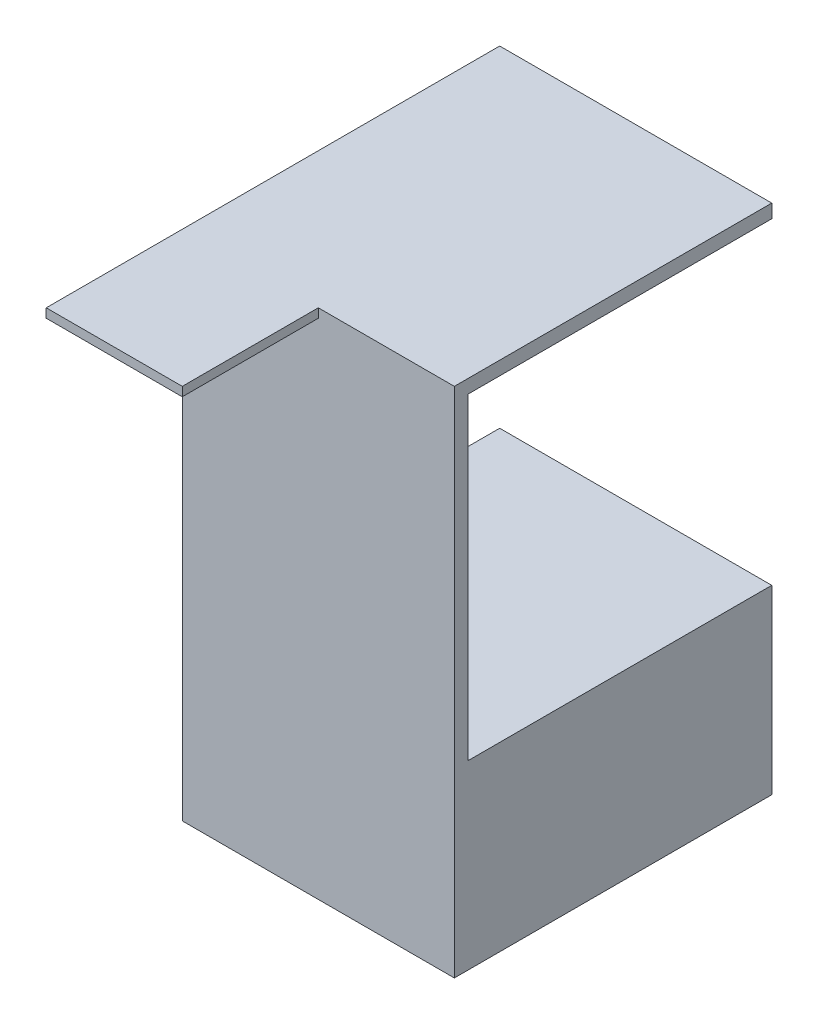
from build123d import *

# Parameters (mm, degrees)
SKETCH1_W           = 700
SKETCH1_H           = 600
BOSS_EXTRUDE1_DEPTH = 30
SKETCH2_W           = 600
SKETCH2_H           = 700
BOSS_EXTRUDE2_DEPTH = 30
SKETCH3_W           = 600
SKETCH3_H           = 400
BOSS_EXTRUDE3_DEPTH = 700
SKETCH4_W           = 300
SKETCH4_H           = 20
BOSS_EXTRUDE4_DEPTH = 300


with BuildPart() as part:
    # Sketch1 → Boss-Extrude1 (new body)
    with BuildSketch(Plane(origin=(0, 0, 0), x_dir=(0, 1, 0), z_dir=(0, 0, 1))):
        Rectangle(SKETCH1_W, SKETCH1_H)
    extrude(amount=BOSS_EXTRUDE1_DEPTH)

    # Sketch2 → Boss-Extrude2 (add)
    with BuildSketch(Plane(origin=(0, 350, 0), x_dir=(-1, 0, 0), z_dir=(0, 1, 0))):
        with Locations((0, -320)):
            Rectangle(SKETCH2_W, SKETCH2_H)
    extrude(amount=BOSS_EXTRUDE2_DEPTH)

    # Sketch3 → Boss-Extrude3 (add)
    with BuildSketch(Plane.XY.offset(30)):
        with Locations((0, -550)):
            Rectangle(SKETCH3_W, SKETCH3_H)
    extrude(amount=-BOSS_EXTRUDE3_DEPTH)

    # Sketch4 → Boss-Extrude4 (add)
    with BuildSketch(Plane.XY.offset(30)):
        with Locations((-150, 370)):
            Rectangle(SKETCH4_W, SKETCH4_H)
    extrude(amount=BOSS_EXTRUDE4_DEPTH)


solid = part.part
